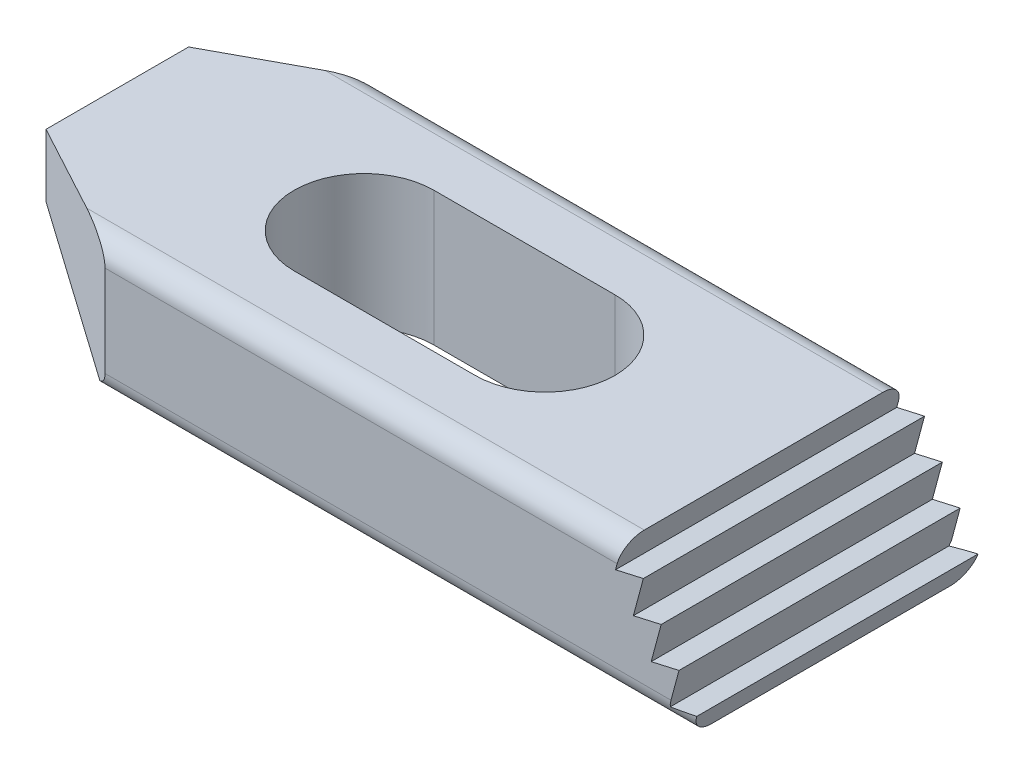
from build123d import *

# Parameters (mm, degrees)
BOSS_EXTRUDE1_DEPTH = 25.0444
CUT_EXTRUDE1_DEPTH  = 60.520050184
LPATTERN1_COUNT     = 11
LPATTERN1_PITCH     = 3.175
CUT_EXTRUDE2_DEPTH  = 60.520050184
FILLET1_R           = 1.905


with BuildPart() as part:
    # Sketch1 → Boss-Extrude1 (new body)
    with BuildSketch(Plane.XY):
        Polygon((0, 0), (52.07, 0), (52.658318987, 1.811473978), (46.811766462, 11.938), (-11.476681013, 11.938), (-11.476681013, 6.35), align=None)
    extrude(amount=BOSS_EXTRUDE1_DEPTH)

    # Sketch2 → Cut-Extrude1 (cut, through all)
    with BuildSketch(Plane.XY.offset(25.0444)):
        Polygon((51.070818987, 4.561104635), (50.181267753, 1.249497834), (52.658318987, 1.811473978), align=None)
    cut_extrude1 = extrude(amount=-CUT_EXTRUDE1_DEPTH, mode=Mode.SUBTRACT)

    # LPattern1: Cut-Extrude1 ×11
    with Locations(*[Vector(-0.49999999999999795, 0.8660254037844398, 0) * (i * LPATTERN1_PITCH) for i in range(1, LPATTERN1_COUNT)]):
        add(cut_extrude1, mode=Mode.SUBTRACT)

    # Sketch3 → Cut-Extrude2 (cut, through all)
    with BuildSketch(Plane(origin=(0, 11.938, 0), x_dir=(1, 0, 0), z_dir=(0, 1, 0))):
        with BuildLine():
            Line((10.494318987, -6.2992), (26.623318987, -6.2992))
            ThreePointArc((26.623318987, -6.2992), (32.846318987, -12.5222), (26.623318987, -18.7452))
            Line((26.623318987, -18.7452), (10.494318987, -18.7452))
            ThreePointArc((10.494318987, -18.7452), (4.271318987, -12.5222), (10.494318987, -6.2992))
        make_face()
        Polygon((-11.476681013, -6.1722), (-0.046681013, 0), (-11.476681013, 0), align=None)
        Polygon((-11.476681013, -25.0444), (-0.046681013, -25.0444), (-11.476681013, -18.8722), align=None)
    extrude(amount=-CUT_EXTRUDE2_DEPTH, mode=Mode.SUBTRACT)

    # Fillet1
    fillet1_edges = [part.edges().sort_by_distance(p)[0] for p in [
        (23.013702779, 11.938, 25.0444),
        (23.013702779, 11.938, 0),
        (26.035, 0, 0),
        (26.035, 0, 25.0444),
    ]]
    fillet(fillet1_edges, radius=FILLET1_R)


solid = part.part
